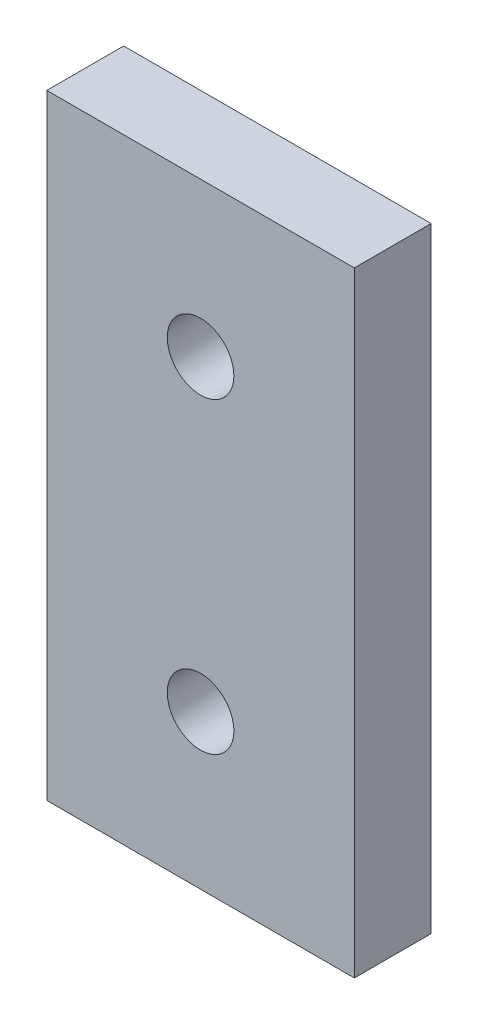
from build123d import *

# Parameters (mm, degrees)
ESQUISSE1_W             = 25.4
ESQUISSE1_H             = 50.8
BOSS_EXTRU_1_DEPTH      = 6.35
ESQUISSE2_R             = 2.75
ENL_V_MAT_EXTRU_1_DEPTH = 6.35


with BuildPart() as part:
    # Esquisse1 → Boss.-Extru.1 (new body)
    with BuildSketch(Plane.XY):
        Rectangle(ESQUISSE1_W, ESQUISSE1_H)
    extrude(amount=BOSS_EXTRU_1_DEPTH)

    # Esquisse2 → Enlèv. mat.-Extru.1 (cut)
    with BuildSketch(Plane.XY.offset(6.35)):
        with Locations((0, 12.7)):
            Circle(ESQUISSE2_R)
        with Locations(Location((0, -12.7, 0), (0, 0, 180))):
            Circle(ESQUISSE2_R)
    extrude(amount=-ENL_V_MAT_EXTRU_1_DEPTH, mode=Mode.SUBTRACT)


solid = part.part
